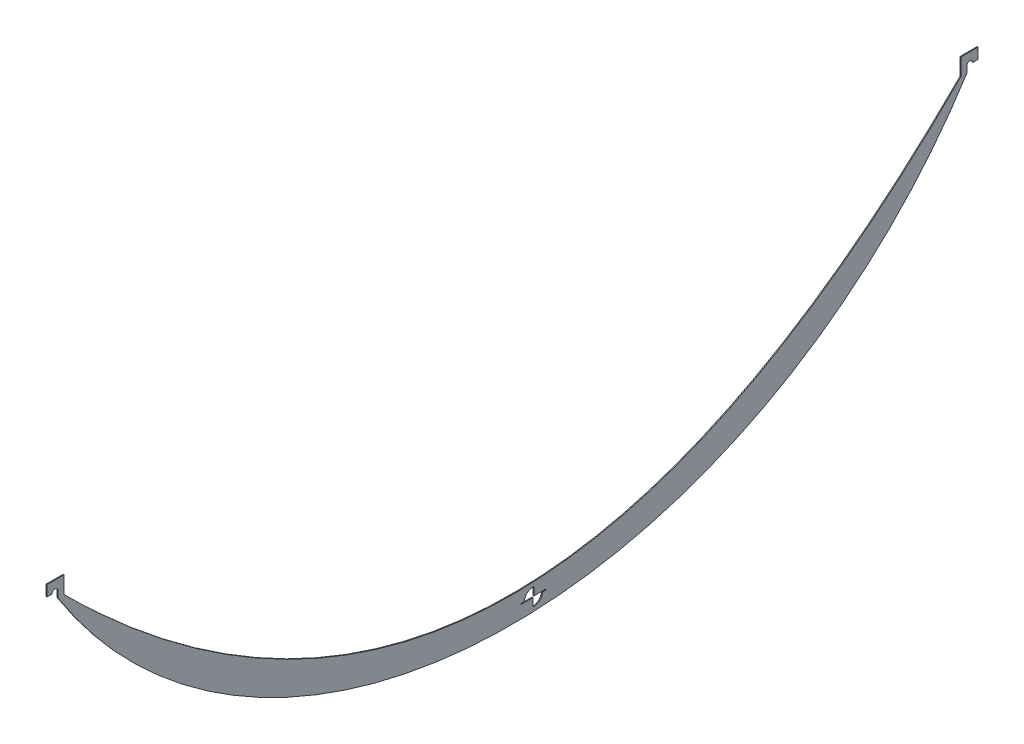
from build123d import *

# Parameters (mm, degrees)
BOSS_EXTRUDE1_DEPTH = 2.54
CUT_EXTRUDE1_DEPTH  = 1438.073344451


with BuildPart() as part:
    # Sketch60 → Boss-Extrude1 (new body)
    with BuildSketch(Plane(origin=(0, 0, 0), x_dir=(0, 0, -1), z_dir=(1, 0, 0))):
        with BuildLine():
            Line((1327.15, 331.787470833), (1327.15, 382.587350833))
            Line((1327.15, 382.587350833), (1377.950002406, 382.587350833))
            Line((1377.950002406, 382.587350833), (1377.950002406, 350.761150833))
            Line((1377.950002406, 350.761150833), (1363.014798129, 350.761150833))
            ThreePointArc((1363.014798129, 350.761150833), (1354.048599065, 359.727349897), (1345.0824, 350.761150833))
            Line((1345.0824, 350.761150833), (1345.0824, 331.787470833))
            ThreePointArc((1345.0824, 331.787470833), (0, -407.954821328), (-1345.0824, 331.787470832))
            Line((-1345.0824, 331.787470832), (-1345.0824, 350.761150833))
            ThreePointArc((-1345.0824, 350.761150833), (-1354.048599065, 359.727349897), (-1363.014798129, 350.761150833))
            Line((-1363.014798129, 350.761150833), (-1377.950002406, 350.761150833))
            Line((-1377.950002406, 350.761150833), (-1377.950002406, 382.587350833))
            Line((-1377.950002406, 382.587350833), (-1327.15, 382.587350833))
            Line((-1327.15, 382.587350833), (-1327.15, 331.787470833))
            add(Edge.make_bspline(
                [(1327.15, 331.787470833), (1e-09, -995.362529167), (-1327.15, 331.787470833)],
                knots=[0, 0, 0, 1, 1, 1], degree=2))
        make_face()
    extrude(amount=BOSS_EXTRUDE1_DEPTH)

    # Sketch61 → Cut-Extrude1 (cut, through all)
    with BuildSketch(Plane(origin=(2.54, 0, 0), x_dir=(0, 0, -1), z_dir=(1, 0, 0))):
        with BuildLine():
            Line((63.280114483, -343.002479543), (63.280114483, -367.132479543))
            Line((63.280114483, -367.132479543), (98.840114483, -367.132479543))
            Line((98.840114483, -367.132479543), (98.840114483, -369.672479543))
            Line((98.840114483, -369.672479543), (88.680114483, -369.672479543))
            ThreePointArc((88.680114483, -369.672479543), (80.80611969, -386.817485024), (63.280114483, -393.802479543))
            Line((63.280114483, -393.802479543), (60.740114483, -393.802479543))
            Line((60.740114483, -393.802479543), (60.740114483, -369.672479543))
            Line((60.740114483, -369.672479543), (25.180114483, -369.672479543))
            Line((25.180114483, -369.672479543), (25.180114483, -367.132479543))
            Line((25.180114483, -367.132479543), (35.340114483, -367.132479543))
            ThreePointArc((35.340114483, -367.132479543), (43.214109276, -349.987474062), (60.740114483, -343.002479543))
            Line((60.740114483, -343.002479543), (63.280114483, -343.002479543))
        make_face()
    extrude(amount=-CUT_EXTRUDE1_DEPTH, mode=Mode.SUBTRACT)


solid = part.part
